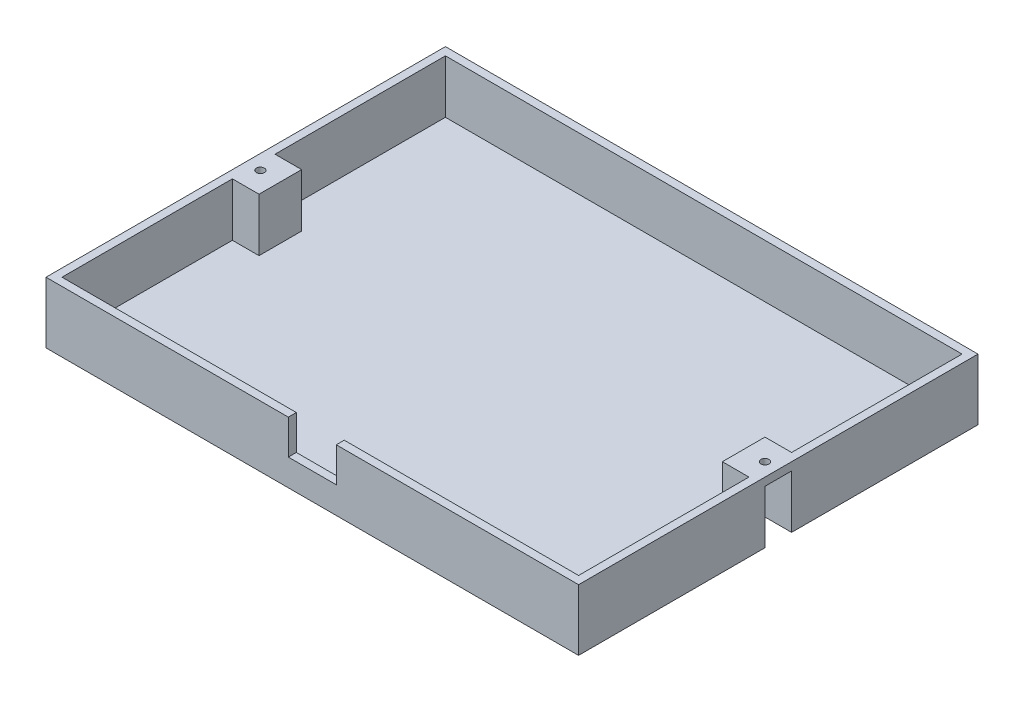
from build123d import *

# Parameters (mm, degrees)
SKETCH1_W           = 200
SKETCH1_H           = 150
BOSS_EXTRUDE1_DEPTH = 3
BOSS_EXTRUDE2_DEPTH = 20
SKETCH3_W           = 10
SKETCH3_H           = 10
BOSS_EXTRUDE3_DEPTH = 3
SKETCH4_W           = 10
SKETCH4_H           = 10
CUT_EXTRUDE1_DEPTH  = 127.589889012
SKETCH5_W           = 10
SKETCH5_H           = 10
BOSS_EXTRUDE4_DEPTH = 3
SKETCH6_W           = 10
SKETCH6_H           = 10
CUT_EXTRUDE2_DEPTH  = 3
SKETCH7_R           = 1.5
CUT_EXTRUDE3_DEPTH  = 127.589889012
SKETCH8_R           = 1.5
CUT_EXTRUDE4_DEPTH  = 127.589889012
SKETCH10_W          = 18
SKETCH10_H          = 13
CUT_EXTRUDE5_DEPTH  = 3


with BuildPart() as part:
    # Sketch1 → Boss-Extrude1 (new body)
    with BuildSketch(Plane(origin=(0, 0, 0), x_dir=(1, 0, 0), z_dir=(0, 1, 0))):
        Rectangle(SKETCH1_W, SKETCH1_H)
    extrude(amount=BOSS_EXTRUDE1_DEPTH)

    # Sketch2 → Boss-Extrude2 (add)
    with BuildSketch(Plane(origin=(0, 3, 0), x_dir=(1, 0, 0), z_dir=(0, 1, 0))):
        Polygon((100, -5), (90, -5), (90, 5), (100, 5), (100, 75), (-100, 75), (-100, 5), (-90, 5), (-90, -5), (-100, -5), (-100, -75), (100, -75), align=None)
        Polygon((97, -8), (87, -8), (87, 8), (97, 8), (97, 72), (-97, 72), (-97, 8), (-87, 8), (-87, -8), (-97, -8), (-97, -72), (97, -72), align=None, mode=Mode.SUBTRACT)
    extrude(amount=BOSS_EXTRUDE2_DEPTH)

    # Sketch3 → Boss-Extrude3 (add)
    with BuildSketch(Plane(origin=(0, 23, 0), x_dir=(1, 0, 0), z_dir=(0, 1, 0))):
        with Locations((-95, 0)):
            Rectangle(SKETCH3_W, SKETCH3_H)
    extrude(amount=-BOSS_EXTRUDE3_DEPTH)

    # Sketch4 → Cut-Extrude1 (cut, through all)
    with BuildSketch(Plane(origin=(0, 3, 0), x_dir=(1, 0, 0), z_dir=(0, 1, 0))):
        with Locations((-95, 0)):
            Rectangle(SKETCH4_W, SKETCH4_H)
    extrude(amount=-CUT_EXTRUDE1_DEPTH, mode=Mode.SUBTRACT)

    # Sketch5 → Boss-Extrude4 (add)
    with BuildSketch(Plane(origin=(0, 23, 0), x_dir=(1, 0, 0), z_dir=(0, 1, 0))):
        with Locations((95, 0)):
            Rectangle(SKETCH5_W, SKETCH5_H)
    extrude(amount=-BOSS_EXTRUDE4_DEPTH)

    # Sketch6 → Cut-Extrude2 (cut)
    with BuildSketch(Plane(origin=(0, 3, 0), x_dir=(1, 0, 0), z_dir=(0, 1, 0))):
        with Locations((95, 0)):
            Rectangle(SKETCH6_W, SKETCH6_H)
    extrude(amount=-CUT_EXTRUDE2_DEPTH, mode=Mode.SUBTRACT)

    # Sketch7 → Cut-Extrude3 (cut, through all)
    with BuildSketch(Plane.XZ.offset(-20)):
        with Locations(Location((95, 0, 0), (0, 0, 270))):
            Circle(SKETCH7_R)
    extrude(amount=-CUT_EXTRUDE3_DEPTH, mode=Mode.SUBTRACT)

    # Sketch8 → Cut-Extrude4 (cut, through all)
    with BuildSketch(Plane.XZ.offset(-20)):
        with Locations(Location((-94.5, 0, 0), (0, 0, 270))):
            Circle(SKETCH8_R)
    extrude(amount=-CUT_EXTRUDE4_DEPTH, mode=Mode.SUBTRACT)

    # Sketch10 → Cut-Extrude5 (cut)
    with BuildSketch(Plane.XY.offset(75)):
        with Locations((0, 16.5)):
            Rectangle(SKETCH10_W, SKETCH10_H)
    extrude(amount=-CUT_EXTRUDE5_DEPTH, mode=Mode.SUBTRACT)


solid = part.part
